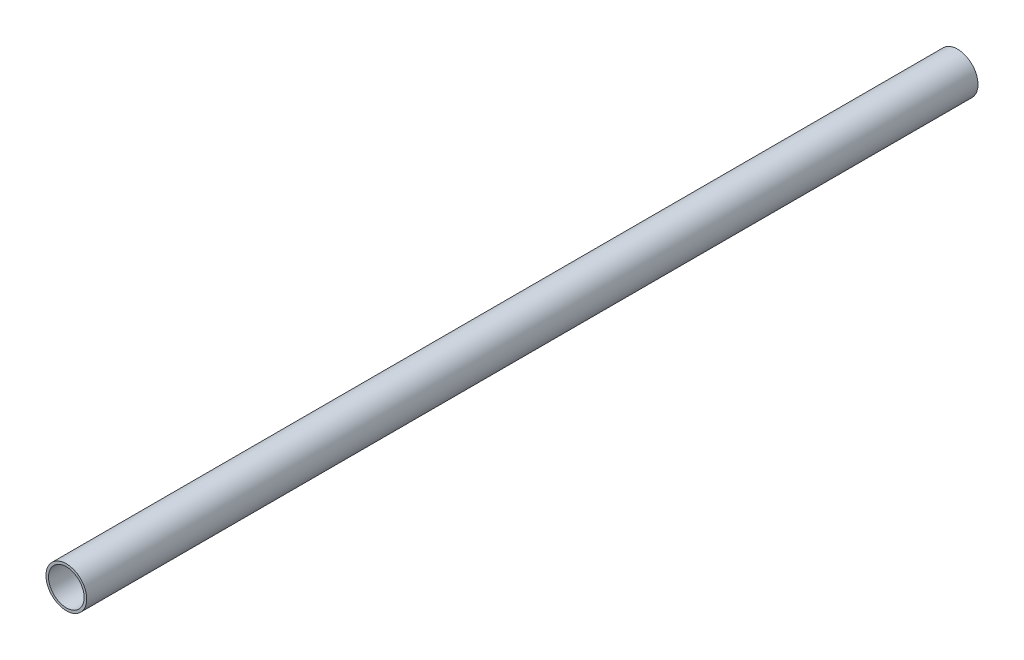
from build123d import *

# Parameters (mm, degrees)
SKETCH1_R           = 16
SKETCH1_R_2         = 14
BOSS_EXTRUDE1_DEPTH = 700


with BuildPart() as part:
    # Sketch1 → Boss-Extrude1 (new body)
    with BuildSketch(Plane.XY):
        Circle(SKETCH1_R)
        Circle(SKETCH1_R_2, mode=Mode.SUBTRACT)
    extrude(amount=BOSS_EXTRUDE1_DEPTH)


solid = part.part
